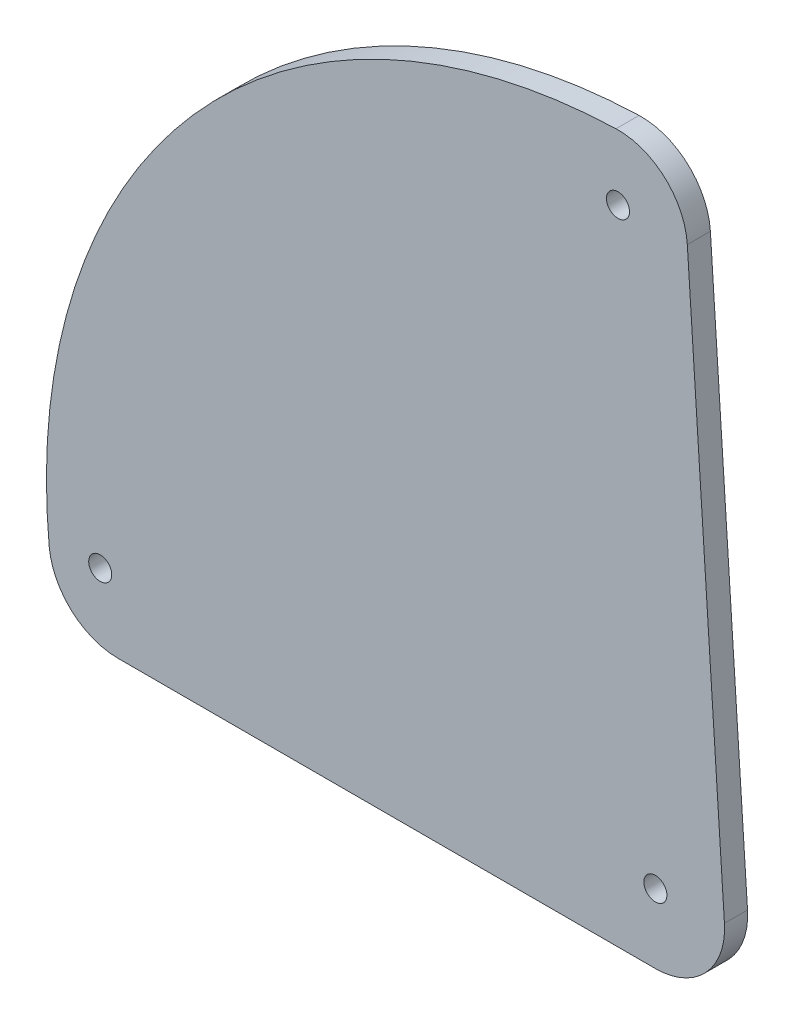
from build123d import *

# Parameters (mm, degrees)
SKETCH_1_R      = 2.5
EXTRUDE_1_DEPTH = 5


with BuildPart() as part:
    # 草图1 → 凸台-拉伸1 (new body)
    with BuildSketch(Plane.XY.offset(-18.206005243)):
        with BuildLine():
            Line((3.867902109, -69.618015729), (120.299999998, -69.618015729))
            ThreePointArc((120.299999998, -69.618015729), (131.246322711, -64.87364925), (135.268196544, -53.641751587))
            Line((135.268196544, -53.641751587), (127.222902207, 69.709644702))
            ThreePointArc((127.222902207, 69.709644702), (122.332732456, 79.843437948), (111.771655863, 83.725600612))
            ThreePointArc((111.771655863, 83.725600612), (20.072255788, 40.438021966), (-11.06192974, -56.06719515))
            ThreePointArc((-11.06192974, -56.06719515), (-6.21332571, -65.725168634), (3.867902109, -69.618015729))
        make_face()
        with Locations(Location((120.299999998, -54.618015744, 0), (0, 0, 180))):
            Circle(SKETCH_1_R, mode=Mode.SUBTRACT)
        with Locations(Location((112.197007482, 69.618015729, 0), (0, 0, 180))):
            Circle(SKETCH_1_R, mode=Mode.SUBTRACT)
        with Locations(Location((0, -54.618015729, 0), (0, 0, 180))):
            Circle(SKETCH_1_R, mode=Mode.SUBTRACT)
    extrude(amount=-EXTRUDE_1_DEPTH)


solid = part.part
